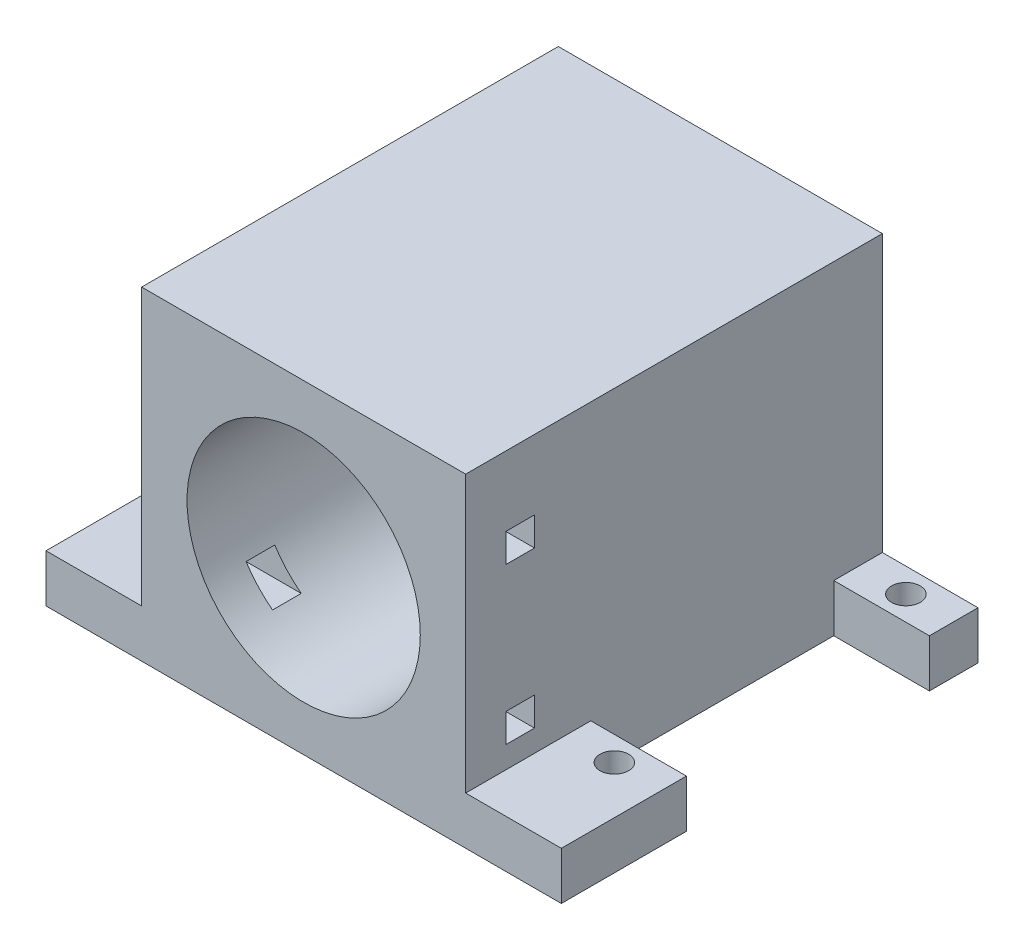
from build123d import *

# Parameters (mm, degrees)
SKETCH1_R           = 3.5
BOSS_EXTRUDE1_DEPTH = 17.78
SKETCH2_R           = 12.192
CUT_EXTRUDE1_DEPTH  = 15.24
CUT_EXTRUDE3_REACH  = 49.719
SKETCH4_W           = 2
SKETCH4_H           = 2
CUT_EXTRUDE4_REACH  = 45.308
SKETCH5_R           = 1.5
SKETCH5_W           = 10
SKETCH5_H           = 25.4
CUT_EXTRUDE5_REACH  = 38.451
SKETCH2_2_R         = 12.192
SKETCH6_R           = 12.192
BOSS_EXTRUDE2_DEPTH = 8
CUT_EXTRUDE6_REACH  = 55.634
SKETCH7_W           = 3
SKETCH7_H           = 3


with BuildPart() as part:
    # Sketch1 → Boss-Extrude1 (new, symmetric)
    with BuildSketch(Plane.XY):
        Polygon((26.938, -11.938), (16.938, -11.938), (16.938, 16.938), (-16.938, 16.938), (-16.938, -11.938), (-26.938, -11.938), (-26.938, -16.938), (26.938, -16.938), align=None)
        Circle(SKETCH1_R, mode=Mode.SUBTRACT)
    extrude(amount=BOSS_EXTRUDE1_DEPTH, both=True)

    # Sketch2 → Cut-Extrude1 (cut, symmetric)
    with BuildSketch(Plane.XY):
        Circle(SKETCH2_R)
    extrude(amount=CUT_EXTRUDE1_DEPTH, both=True, mode=Mode.SUBTRACT)

    # Sketch4 → Cut-Extrude3 (cut, up to next)
    with BuildSketch(Plane.XY.offset(17.78), mode=Mode.PRIVATE) as cut_extrude3_sk1:
        with Locations((-10.219, -1)):
            Rectangle(SKETCH4_W, SKETCH4_H)
    cut_extrude3_tool1 = extrude(cut_extrude3_sk1.sketch, amount=-CUT_EXTRUDE3_REACH, mode=Mode.PRIVATE) & part.part
    # Sketch4 → Cut-Extrude3 (cut, up to next)
    with BuildSketch(Plane.XY.offset(17.78), mode=Mode.PRIVATE) as cut_extrude3_sk2:
        with Locations((10.219, -1)):
            Rectangle(SKETCH4_W, SKETCH4_H)
    cut_extrude3_tool2 = extrude(cut_extrude3_sk2.sketch, amount=-CUT_EXTRUDE3_REACH, mode=Mode.PRIVATE) & part.part
    add(cut_extrude3_tool1.solids().sort_by_distance((-10.219, -1, 17.78))[0], mode=Mode.SUBTRACT)
    add(cut_extrude3_tool2.solids().sort_by_distance((10.219, -1, 17.78))[0], mode=Mode.SUBTRACT)

    # Sketch5 → Cut-Extrude4 (cut, up to next)
    with BuildSketch(Plane(origin=(0, -11.938, 0), x_dir=(1, 0, 0), z_dir=(0, 1, 0)), mode=Mode.PRIVATE) as cut_extrude4_sk1:
        with Locations(Location((-21.938, 15.24, 0), (0, 0, 270))):
            Circle(SKETCH5_R)
    cut_extrude4_tool1 = extrude(cut_extrude4_sk1.sketch, amount=-CUT_EXTRUDE4_REACH, mode=Mode.PRIVATE) & part.part
    # Sketch5 → Cut-Extrude4 (cut, up to next)
    with BuildSketch(Plane(origin=(0, -11.938, 0), x_dir=(1, 0, 0), z_dir=(0, 1, 0)), mode=Mode.PRIVATE) as cut_extrude4_sk2:
        with Locations(Location((21.938, 15.24, 0), (0, 0, 90))):
            Circle(SKETCH5_R)
    cut_extrude4_tool2 = extrude(cut_extrude4_sk2.sketch, amount=-CUT_EXTRUDE4_REACH, mode=Mode.PRIVATE) & part.part
    # Sketch5 → Cut-Extrude4 (cut, up to next)
    with BuildSketch(Plane(origin=(0, -11.938, 0), x_dir=(1, 0, 0), z_dir=(0, 1, 0)), mode=Mode.PRIVATE) as cut_extrude4_sk3:
        with Locations(Location((21.938, -15.24, 0), (0, 0, 270))):
            Circle(SKETCH5_R)
    cut_extrude4_tool3 = extrude(cut_extrude4_sk3.sketch, amount=-CUT_EXTRUDE4_REACH, mode=Mode.PRIVATE) & part.part
    # Sketch5 → Cut-Extrude4 (cut, up to next)
    with BuildSketch(Plane(origin=(0, -11.938, 0), x_dir=(1, 0, 0), z_dir=(0, 1, 0)), mode=Mode.PRIVATE) as cut_extrude4_sk4:
        with Locations(Location((-21.938, -15.24, 0), (0, 0, 90))):
            Circle(SKETCH5_R)
    cut_extrude4_tool4 = extrude(cut_extrude4_sk4.sketch, amount=-CUT_EXTRUDE4_REACH, mode=Mode.PRIVATE) & part.part
    # Sketch5 → Cut-Extrude4 (cut, up to next)
    with BuildSketch(Plane(origin=(0, -11.938, 0), x_dir=(1, 0, 0), z_dir=(0, 1, 0)), mode=Mode.PRIVATE) as cut_extrude4_sk5:
        with Locations((-21.938, 0)):
            Rectangle(SKETCH5_W, SKETCH5_H)
    cut_extrude4_tool5 = extrude(cut_extrude4_sk5.sketch, amount=-CUT_EXTRUDE4_REACH, mode=Mode.PRIVATE) & part.part
    # Sketch5 → Cut-Extrude4 (cut, up to next)
    with BuildSketch(Plane(origin=(0, -11.938, 0), x_dir=(1, 0, 0), z_dir=(0, 1, 0)), mode=Mode.PRIVATE) as cut_extrude4_sk6:
        with Locations((21.938, 0)):
            Rectangle(SKETCH5_W, SKETCH5_H)
    cut_extrude4_tool6 = extrude(cut_extrude4_sk6.sketch, amount=-CUT_EXTRUDE4_REACH, mode=Mode.PRIVATE) & part.part
    add(cut_extrude4_tool1.solids().sort_by_distance((-21.938, -11.938, -15.24))[0], mode=Mode.SUBTRACT)
    add(cut_extrude4_tool2.solids().sort_by_distance((21.938, -11.938, -15.24))[0], mode=Mode.SUBTRACT)
    add(cut_extrude4_tool3.solids().sort_by_distance((21.938, -11.938, 15.24))[0], mode=Mode.SUBTRACT)
    add(cut_extrude4_tool4.solids().sort_by_distance((-21.938, -11.938, 15.24))[0], mode=Mode.SUBTRACT)
    add(cut_extrude4_tool5.solids().sort_by_distance((-21.938, -11.938, 0))[0], mode=Mode.SUBTRACT)
    add(cut_extrude4_tool6.solids().sort_by_distance((21.938, -11.938, 0))[0], mode=Mode.SUBTRACT)

    # Sketch2<2> → Cut-Extrude5 (cut, up to next)
    with BuildSketch(Plane.XY, mode=Mode.PRIVATE) as cut_extrude5_sk1:
        Circle(SKETCH2_2_R)
    cut_extrude5_tool1 = extrude(cut_extrude5_sk1.sketch, amount=CUT_EXTRUDE5_REACH, mode=Mode.PRIVATE) & part.part
    add(cut_extrude5_tool1.solids().sort_by_distance((0, 0, 0))[0], mode=Mode.SUBTRACT)

    # Sketch6 → Boss-Extrude2 (add)
    with BuildSketch(Plane.XY.offset(17.78)):
        Polygon((-16.938, -11.938), (-26.938, -11.938), (-26.938, -16.938), (26.938, -16.938), (26.938, -11.938), (16.938, -11.938), (16.938, 16.938), (-16.938, 16.938), align=None)
        Circle(SKETCH6_R, mode=Mode.SUBTRACT)
    extrude(amount=BOSS_EXTRUDE2_DEPTH)

    # Cut-Extrude6: up to this face of the body (flat: up to its plane)
    cut_extrude6_end = Plane(part.part.faces().sort_by_distance((-16.938, 0.946659371, 3.633170238))[0])
    # Sketch7 → Cut-Extrude6 (cut, up to the picked face)
    with BuildSketch(Plane(origin=(16.938, 0, 0), x_dir=(0, 0, -1), z_dir=(1, 0, 0)), mode=Mode.PRIVATE) as cut_extrude6_sk1:
        with Locations((-20.0876, 8.152)):
            Rectangle(SKETCH7_W, SKETCH7_H)
    cut_extrude6_tool1 = split(extrude(cut_extrude6_sk1.sketch, amount=-CUT_EXTRUDE6_REACH, mode=Mode.PRIVATE), bisect_by=cut_extrude6_end, keep=Keep.BOTH, mode=Mode.PRIVATE)
    # Sketch7 → Cut-Extrude6 (cut, up to the picked face)
    with BuildSketch(Plane(origin=(16.938, 0, 0), x_dir=(0, 0, -1), z_dir=(1, 0, 0)), mode=Mode.PRIVATE) as cut_extrude6_sk2:
        with Locations((-20.0876, -8.152)):
            Rectangle(SKETCH7_W, SKETCH7_H)
    cut_extrude6_tool2 = split(extrude(cut_extrude6_sk2.sketch, amount=-CUT_EXTRUDE6_REACH, mode=Mode.PRIVATE), bisect_by=cut_extrude6_end, keep=Keep.BOTH, mode=Mode.PRIVATE)
    add(cut_extrude6_tool1.solids().sort_by(Axis((16.938, 8.152, 20.0876), (-1, 0, 0)))[0], mode=Mode.SUBTRACT)
    add(cut_extrude6_tool2.solids().sort_by(Axis((16.938, -8.152, 20.0876), (-1, 0, 0)))[0], mode=Mode.SUBTRACT)


solid = part.part
